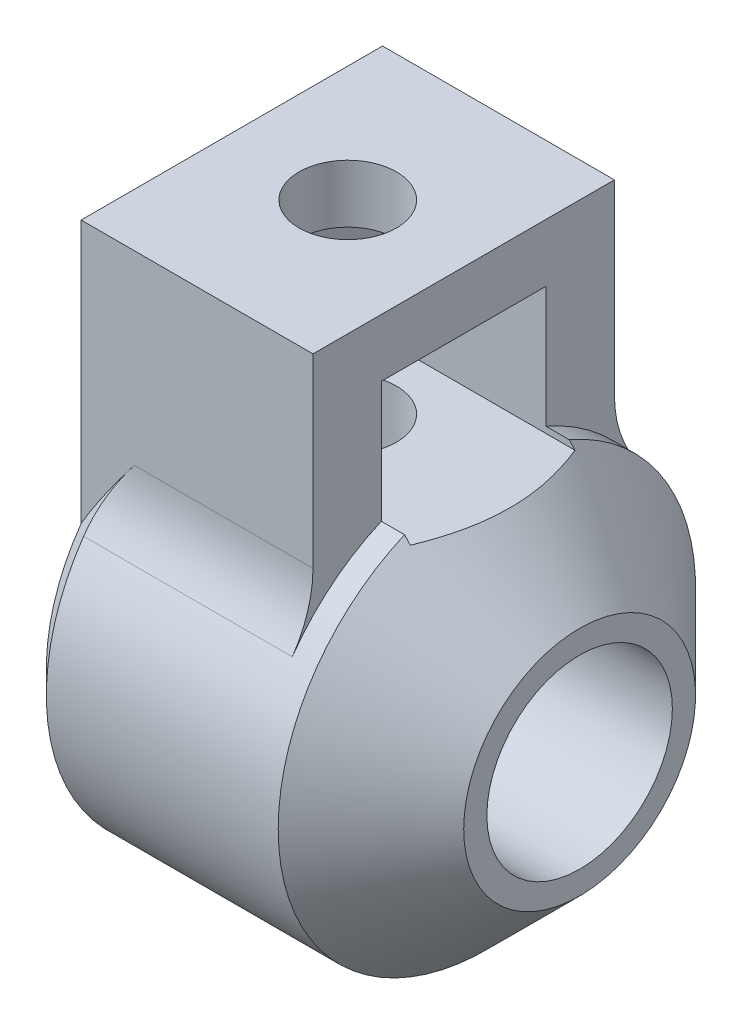
from build123d import *

# Parameters (mm, degrees)
SKETCH2_W               = 13
SKETCH2_H               = 12
BOSS_EXTRUDE1_DEPTH     = 10
CUT_EXTRUDE1_REACH      = 32.512
CUT_EXTRUDE1_END_RADIUS = 4
SKETCH3_R               = 2.1
CUT_EXTRUDE2_START      = -2.5
CUT_EXTRUDE2_DEPTH      = 5.5
FILLET1_R               = 5


with BuildPart() as part:
    # Sketch1 → Revolve1 (revolve)
    with BuildSketch(Plane.XY, mode=Mode.PRIVATE) as revolve1_sk:
        Polygon((0, 4), (15, 4), (15, 5), (11, 9), (1, 9), (0, 8), align=None)
    revolve(revolve1_sk.sketch.rotate(Axis((0, 0, 0), (1, 0, 0)), 90), axis=Axis((0, 0, 0), (1, 0, 0)))

    # Sketch2 → Boss-Extrude1 (add)
    with BuildSketch(Plane.ZY):
        with Locations((0, 10)):
            Rectangle(SKETCH2_W, SKETCH2_H)
    extrude(amount=-BOSS_EXTRUDE1_DEPTH)

    # Cut-Extrude1: up to this cylinder (the profile starts outside it)
    cut_extrude1_end = Plane(origin=(5, 0, 0), z_dir=(-1, 0, 0)) * Cylinder(CUT_EXTRUDE1_END_RADIUS, 74.024, mode=Mode.PRIVATE)
    # Sketch3 → Cut-Extrude1 (cut, up to the surface)
    with BuildSketch(Plane(origin=(0, 16, 0), x_dir=(1, 0, 0), z_dir=(0, 1, 0)), mode=Mode.PRIVATE) as cut_extrude1_sk1:
        with Locations(Location((5, 0, 0), (0, 0, 270))):
            Circle(SKETCH3_R)
    cut_extrude1_tool1 = extrude(cut_extrude1_sk1.sketch, amount=-CUT_EXTRUDE1_REACH, mode=Mode.PRIVATE) - cut_extrude1_end
    add(cut_extrude1_tool1.solids().sort_by_distance((5, 16, 0))[0], mode=Mode.SUBTRACT)

    # Sketch4 → Cut-Extrude2 (cut)
    with BuildSketch(Plane(origin=(0, 16, 0), x_dir=(1, 0, 0), z_dir=(0, 1, 0)).offset(CUT_EXTRUDE2_START)):
        Polygon((7.049593456, 3.55), (15, 3.55), (15, -3.55), (7.049593456, -3.55), (2.950406544, -3.55), (0.900813089, 0), (2.950406544, 3.55), align=None)
    extrude(amount=-CUT_EXTRUDE2_DEPTH, mode=Mode.SUBTRACT)

    # Fillet1
    fillet1_edges = [part.edges().sort_by_distance(p)[0] for p in [
        (5.5, 6.224949799, -6.5),
        (5.5, 6.224949799, 6.5),
    ]]
    fillet(fillet1_edges, radius=FILLET1_R)


solid = part.part
